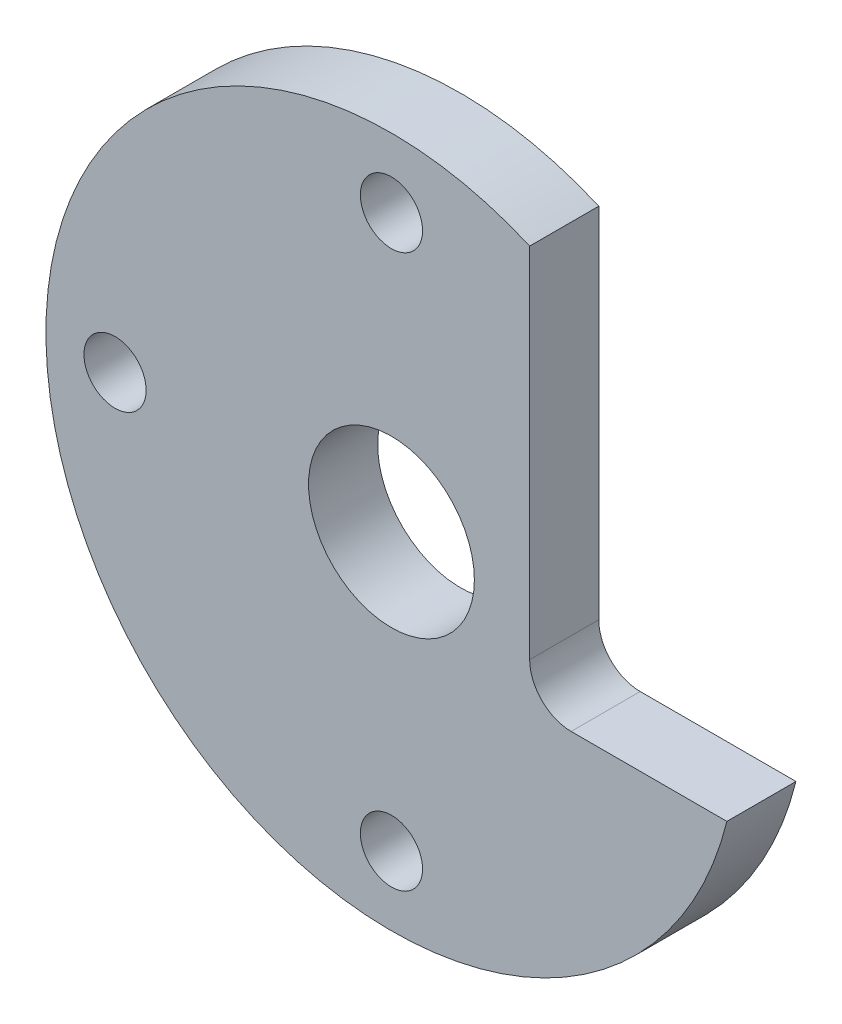
from build123d import *

# Parameters (mm, degrees)
SKIZZE1_R                       = 25
SKIZZE1_R_2                     = 6
SKIZZE1_R_3                     = 2.25
AUFSATZ_LINEAR_AUSTRAGEN1_DEPTH = 5
SKIZZE2_W                       = 24.326966906
SKIZZE2_H                       = 39.351197917
SCHNITT_LINEAR_AUSTRAGEN1_DEPTH = 5
VERRUNDUNG1_R                   = 3


with BuildPart() as part:
    # Skizze1 → Aufsatz-Linear austragen1 (new body)
    with BuildSketch(Plane.XY):
        Circle(SKIZZE1_R)
        Circle(SKIZZE1_R_2, mode=Mode.SUBTRACT)
        with Locations((0, 20)):
            Circle(SKIZZE1_R_3, mode=Mode.SUBTRACT)
        with Locations((-20, 0)):
            Circle(SKIZZE1_R_3, mode=Mode.SUBTRACT)
        with Locations((0, -20)):
            Circle(SKIZZE1_R_3, mode=Mode.SUBTRACT)
    extrude(amount=AUFSATZ_LINEAR_AUSTRAGEN1_DEPTH)

    # Skizze2 → Schnitt-Linear austragen1 (cut)
    with BuildSketch(Plane(origin=(0, 0, 0), x_dir=(-1, 0, 0), z_dir=(0, 0, -1))):
        with Locations((-22.163483453, 13.675598959)):
            Rectangle(SKIZZE2_W, SKIZZE2_H)
    extrude(amount=-SCHNITT_LINEAR_AUSTRAGEN1_DEPTH, mode=Mode.SUBTRACT)

    # Verrundung1
    verrundung1_edges = [part.edges().sort_by_distance(p)[0] for p in [
        (10, -6, 2.5),
    ]]
    fillet(verrundung1_edges, radius=VERRUNDUNG1_R)


solid = part.part
